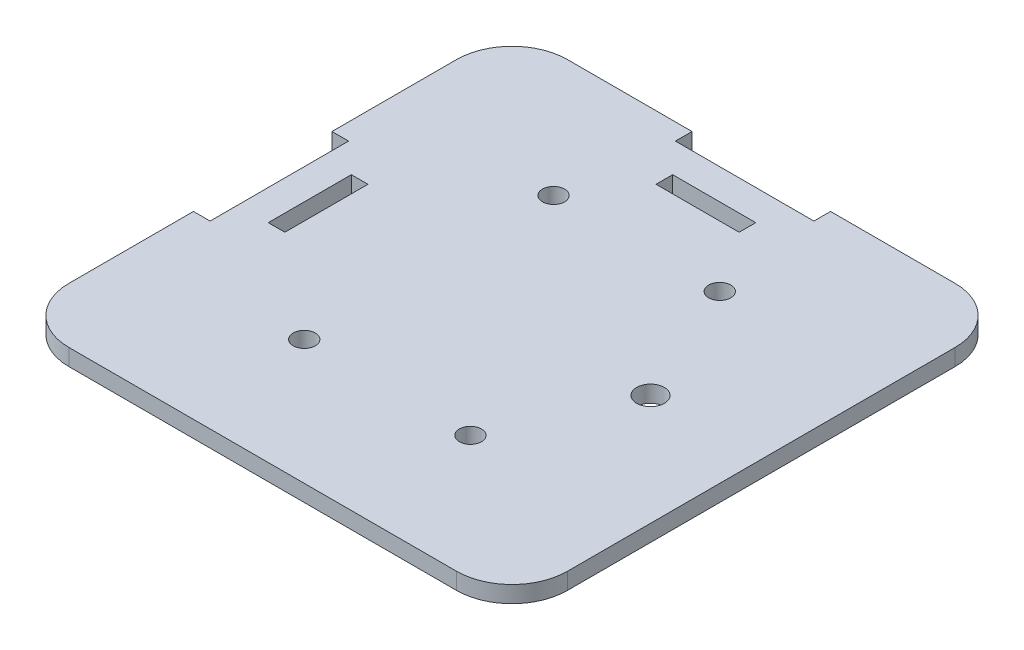
from build123d import *

# Parameters (mm, degrees)
BOSS_EXTRUDE1_DEPTH = 3
SKETCH2_R           = 2
CUT_EXTRUDE1_DEPTH  = 3
SKETCH3_W           = 15
SKETCH3_H           = 3
SKETCH3_W_2         = 3
SKETCH3_H_2         = 15
CUT_EXTRUDE2_DEPTH  = 10
SKETCH4_R           = 2.5
CUT_EXTRUDE3_DEPTH  = 14


with BuildPart() as part:
    # Sketch1 → Boss-Extrude1 (new body)
    with BuildSketch(Plane(origin=(0, 0, 0), x_dir=(1, 0, 0), z_dir=(0, 1, 0))):
        with BuildLine():
            Line((-35, -45), (35, -45))
            ThreePointArc((35, -45), (42.071067812, -42.071067812), (45, -35))
            Line((45, -35), (45, 35))
            ThreePointArc((45, 35), (42.071067812, 42.071067812), (35, 45))
            Line((35, 45), (12.5, 45))
            Line((12.5, 45), (12.5, 42))
            Line((12.5, 42), (-12.5, 42))
            Line((-12.5, 42), (-12.5, 45))
            Line((-12.5, 45), (-35, 45))
            ThreePointArc((-35, 45), (-42.071067812, 42.071067812), (-45, 35))
            Line((-45, 35), (-45, 12.5))
            Line((-45, 12.5), (-42, 12.5))
            Line((-42, 12.5), (-42, -12.5))
            Line((-42, -12.5), (-45, -12.5))
            Line((-45, -12.5), (-45, -35))
            ThreePointArc((-45, -35), (-42.071067812, -42.071067812), (-35, -45))
        make_face()
    extrude(amount=BOSS_EXTRUDE1_DEPTH)

    # Sketch2 → Cut-Extrude1 (cut)
    with BuildSketch(Plane(origin=(0, 3, 0), x_dir=(1, 0, 0), z_dir=(0, 1, 0))):
        with Locations(Location((-15, 22.5, 0), (0, 0, 270))):
            Circle(SKETCH2_R)
        with Locations(Location((15, 22.5, 0), (0, 0, 90))):
            Circle(SKETCH2_R)
        with Locations(Location((15, -22.5, 0), (0, 0, 270))):
            Circle(SKETCH2_R)
        with Locations(Location((-15, -22.5, 0), (0, 0, 90))):
            Circle(SKETCH2_R)
    extrude(amount=-CUT_EXTRUDE1_DEPTH, mode=Mode.SUBTRACT)

    # Sketch3 → Cut-Extrude2 (cut)
    with BuildSketch(Plane(origin=(0, 3, 0), x_dir=(1, 0, 0), z_dir=(0, 1, 0))):
        with Locations((0, 35)):
            Rectangle(SKETCH3_W, SKETCH3_H)
        with Locations((-35, 0)):
            Rectangle(SKETCH3_W_2, SKETCH3_H_2)
    extrude(amount=-CUT_EXTRUDE2_DEPTH, mode=Mode.SUBTRACT)

    # Sketch4 → Cut-Extrude3 (cut)
    with BuildSketch(Plane(origin=(0, 3, 0), x_dir=(1, 0, 0), z_dir=(0, 1, 0))):
        with Locations(Location((25, 0, 0), (0, 0, 270))):
            Circle(SKETCH4_R)
    extrude(amount=-CUT_EXTRUDE3_DEPTH, mode=Mode.SUBTRACT)


solid = part.part
